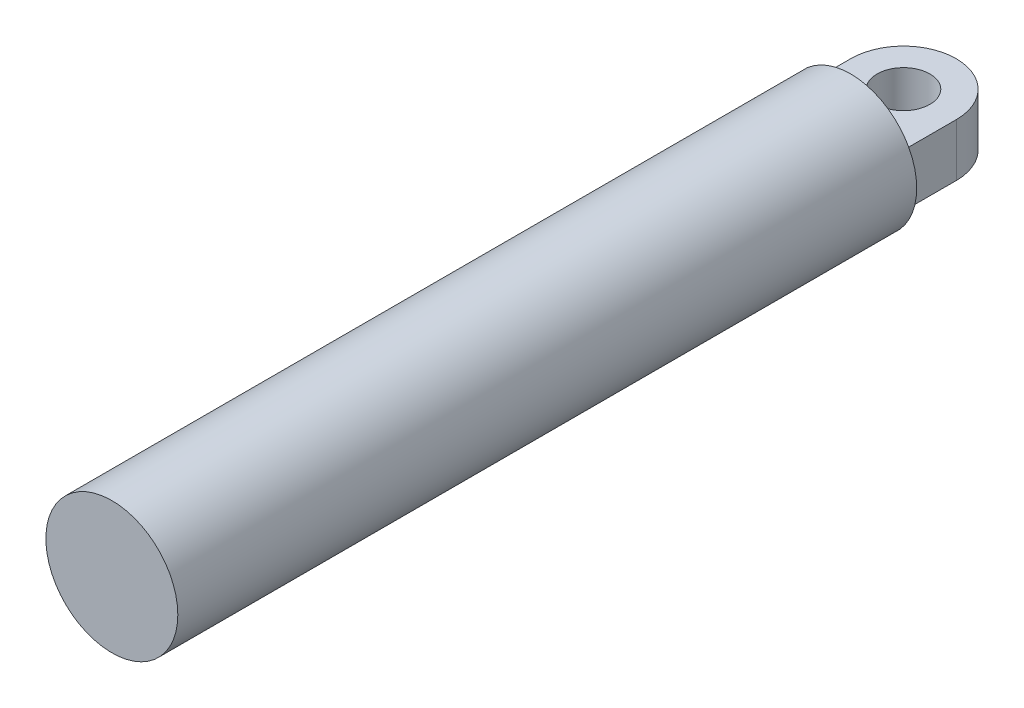
from build123d import *

# Parameters (mm, degrees)
SKETCH_1_R               = 25
EXTRUDE_1_DEPTH          = 30
SKETCH_2_R               = 25
EXTRUDE_2_DEPTH          = 250
SKETCH_3_W               = 40
SKETCH_3_H               = 10
EXTRUDE_4_DEPTH          = 40
CUT_EXTRUDE_1_DEPTH      = 323.877685819
CUT_EXTRUDE_1_DEPTH_BACK = 323.877685819
CUT_EXTRUDE_2_DEPTH      = 323.877685819
CUT_EXTRUDE_2_DEPTH_BACK = 323.877685819
SKETCH_7_R               = 10


with BuildPart() as part:
    # 스케치1 → 보스-돌출1 (new body)
    with BuildSketch(Plane.XY):
        Circle(SKETCH_1_R)
    extrude(amount=-EXTRUDE_1_DEPTH)

    # 스케치2 → 보스-돌출2 (add)
    with BuildSketch(Plane(origin=(0, 0, -30), x_dir=(-1, 0, 0), z_dir=(0, 0, -1))):
        with Locations(Location((0, 0, 0), (0, 0, 180))):
            Circle(SKETCH_2_R)
    extrude(amount=EXTRUDE_2_DEPTH)

    # 스케치3 → 보스-돌출4 (add)
    with BuildSketch(Plane(origin=(0, 0, -280), x_dir=(-1, 0, 0), z_dir=(0, 0, -1))):
        with Locations((0, -5)):
            Rectangle(SKETCH_3_W, SKETCH_3_H)
        with Locations((0, 5)):
            Rectangle(SKETCH_3_W, SKETCH_3_H)
    extrude(amount=EXTRUDE_4_DEPTH)

    # 스케치6 → 컷-돌출1 (cut, two sides: drawn at the far end of the back side and taken through both)
    with BuildSketch(Plane(origin=(0, 10, 0), x_dir=(1, 0, 0), z_dir=(0, 1, 0)).offset(-CUT_EXTRUDE_1_DEPTH_BACK)):
        with BuildLine():
            ThreePointArc((-20, 300), (-14.142135624, 314.142135624), (0, 320))
            Line((0, 320), (-20, 320))
            Line((-20, 320), (-20, 300))
        make_face()
        with BuildLine():
            Line((20, 320), (0, 320))
            ThreePointArc((0, 320), (14.142135624, 314.142135624), (20, 300))
            Line((20, 300), (20, 320))
        make_face()
    extrude(amount=CUT_EXTRUDE_1_DEPTH + CUT_EXTRUDE_1_DEPTH_BACK, mode=Mode.SUBTRACT)

    # 스케치7 → 컷-돌출2 (cut, two sides: drawn at the far end of the back side and taken through both)
    with BuildSketch(Plane(origin=(0, 10, 0), x_dir=(1, 0, 0), z_dir=(0, 1, 0)).offset(-CUT_EXTRUDE_2_DEPTH_BACK)):
        with Locations(Location((0, 300, 0), (0, 0, 270))):
            Circle(SKETCH_7_R)
    extrude(amount=CUT_EXTRUDE_2_DEPTH + CUT_EXTRUDE_2_DEPTH_BACK, mode=Mode.SUBTRACT)


solid = part.part
